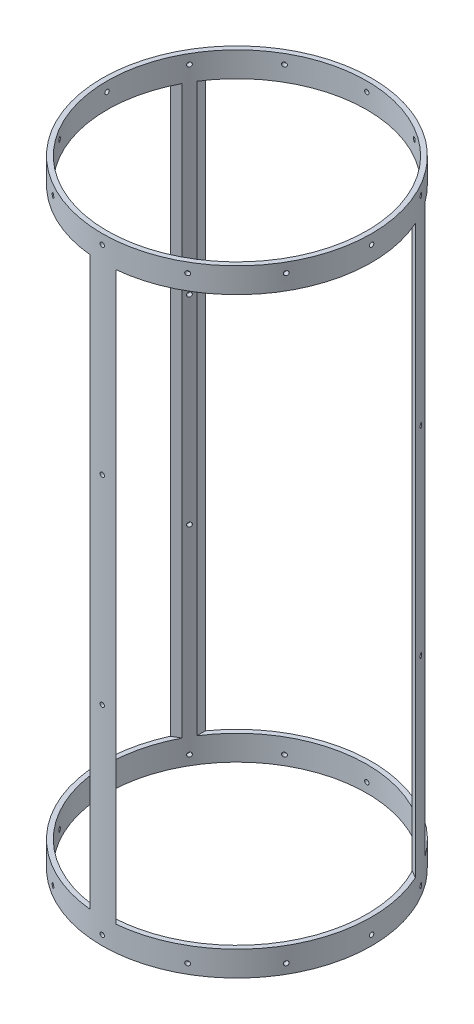
from build123d import *

# Parameters (mm, degrees)
SKETCH1_R                = 88.9
SKETCH1_R_2              = 85.725
BOSS_EXTRUDE1_DEPTH      = 203.581
CUT_EXTRUDE1_REACH       = 241.273
CUT_EXTRUDE1_END_RADIUS  = 88.9
SKETCH2_W                = 144.78
SKETCH2_H                = 374.142
CIRPATTERN1_COUNT        = 3
SKETCH4_R                = 1.4351
CUT_EXTRUDE3_DEPTH       = 15.24
CIRPATTERN3_COUNT        = 12
MIRROR1_COPY_1_SKETCH_R  = 1.4351
MIRROR1_COPY_1_DEPTH     = 15.24
MIRROR1_COPY_2_SKETCH_R  = 1.4351
MIRROR1_COPY_2_DEPTH     = 15.24
MIRROR1_COPY_3_SKETCH_R  = 1.4351
MIRROR1_COPY_3_DEPTH     = 15.24
MIRROR1_COPY_4_SKETCH_R  = 1.4351
MIRROR1_COPY_4_DEPTH     = 15.24
MIRROR1_COPY_5_SKETCH_R  = 1.4351
MIRROR1_COPY_5_DEPTH     = 15.24
MIRROR1_COPY_6_SKETCH_R  = 1.4351
MIRROR1_COPY_6_DEPTH     = 15.24
MIRROR1_COPY_7_SKETCH_R  = 1.4351
MIRROR1_COPY_7_DEPTH     = 15.24
MIRROR1_COPY_8_SKETCH_R  = 1.4351
MIRROR1_COPY_8_DEPTH     = 15.24
MIRROR1_COPY_9_SKETCH_R  = 1.4351
MIRROR1_COPY_9_DEPTH     = 15.24
MIRROR1_COPY_10_SKETCH_R = 1.4351
MIRROR1_COPY_10_DEPTH    = 15.24
MIRROR1_COPY_11_SKETCH_R = 1.4351
MIRROR1_COPY_11_DEPTH    = 15.24
SKETCH5_R                = 1.4351
CUT_EXTRUDE4_DEPTH       = 46.482
CIRPATTERN4_COUNT        = 3


with BuildPart() as part:
    # Sketch1 → Boss-Extrude1 (new, symmetric)
    with BuildSketch(Plane(origin=(0, 0, 0), x_dir=(1, 0, 0), z_dir=(0, 1, 0))):
        with Locations(Location((0, 0, 0), (0, 0, 270))):
            Circle(SKETCH1_R)
        with Locations(Location((0, 0, 0), (0, 0, 270))):
            Circle(SKETCH1_R_2, mode=Mode.SUBTRACT)
    extrude(amount=BOSS_EXTRUDE1_DEPTH, both=True)

    # Cut-Extrude1: up to this cylinder (the profile starts inside it)
    cut_extrude1_end = Plane(origin=(0, 0, 0), z_dir=(0, -1, 0)) * Cylinder(CUT_EXTRUDE1_END_RADIUS, 661.346, mode=Mode.PRIVATE)
    # Sketch2 → Cut-Extrude1 (cut, up to the surface)
    with BuildSketch(Plane.XY, mode=Mode.PRIVATE) as cut_extrude1_sk1:
        Rectangle(SKETCH2_W, SKETCH2_H)
    cut_extrude1_tool1 = extrude(cut_extrude1_sk1.sketch, amount=-CUT_EXTRUDE1_REACH, mode=Mode.PRIVATE) & cut_extrude1_end
    cut_extrude1 = cut_extrude1_tool1.solids().sort_by_distance((0, 0, 0))[0]
    add(cut_extrude1, mode=Mode.SUBTRACT)

    # CirPattern1: Cut-Extrude1 ×3 about axis
    cirpattern1_axis = Axis((0, 0, 0), (0, 1, 0))
    for i in range(1, CIRPATTERN1_COUNT):
        add(cut_extrude1.rotate(cirpattern1_axis, i * 360 / CIRPATTERN1_COUNT), mode=Mode.SUBTRACT)

    # Sketch4 → Cut-Extrude3 (cut)
    with BuildSketch(Plane(origin=(88.9, 0, 0), x_dir=(0, 0, -1), z_dir=(1, 0, 0))):
        with Locations((0, 197.231)):
            Circle(SKETCH4_R)
    cut_extrude3 = extrude(amount=-CUT_EXTRUDE3_DEPTH, mode=Mode.SUBTRACT)

    # CirPattern3: Cut-Extrude3 ×12 about axis
    cirpattern3_axis = Axis((0, 203.581, 0), (0, -1, 0))
    for i in range(1, CIRPATTERN3_COUNT):
        add(cut_extrude3.rotate(cirpattern3_axis, i * 360 / CIRPATTERN3_COUNT), mode=Mode.SUBTRACT)

    # Mirror1: Cut-Extrude3 across plane
    add(cut_extrude3.mirror(Plane.ZX), mode=Mode.SUBTRACT)

    # Mirror1 copy 1 sketch → Mirror1 copy 1 (cut)
    with BuildSketch(Plane(origin=(76.989658396, 0, 44.45), x_dir=(0.49999999999999994, 0, -0.8660254037844387), z_dir=(0.8660254037844387, 0, 0.49999999999999994))):
        with Locations((0, -197.231)):
            Circle(MIRROR1_COPY_1_SKETCH_R)
    extrude(amount=-MIRROR1_COPY_1_DEPTH, mode=Mode.SUBTRACT)

    # Mirror1 copy 2 sketch → Mirror1 copy 2 (cut)
    with BuildSketch(Plane(origin=(44.45, 0, 76.989658396), x_dir=(0.8660254037844386, 0, -0.5000000000000001), z_dir=(0.5000000000000001, 0, 0.8660254037844386))):
        with Locations((0, -197.231)):
            Circle(MIRROR1_COPY_2_SKETCH_R)
    extrude(amount=-MIRROR1_COPY_2_DEPTH, mode=Mode.SUBTRACT)

    # Mirror1 copy 3 sketch → Mirror1 copy 3 (cut)
    with BuildSketch(Plane.XY.offset(88.9)):
        with Locations((0, -197.231)):
            Circle(MIRROR1_COPY_3_SKETCH_R)
    extrude(amount=-MIRROR1_COPY_3_DEPTH, mode=Mode.SUBTRACT)

    # Mirror1 copy 4 sketch → Mirror1 copy 4 (cut)
    with BuildSketch(Plane(origin=(-44.45, 0, 76.989658396), x_dir=(0.8660254037844387, 0, 0.4999999999999998), z_dir=(-0.4999999999999998, 0, 0.8660254037844387))):
        with Locations((0, -197.231)):
            Circle(MIRROR1_COPY_4_SKETCH_R)
    extrude(amount=-MIRROR1_COPY_4_DEPTH, mode=Mode.SUBTRACT)

    # Mirror1 copy 5 sketch → Mirror1 copy 5 (cut)
    with BuildSketch(Plane(origin=(-76.989658396, 0, 44.45), x_dir=(0.49999999999999994, 0, 0.8660254037844387), z_dir=(-0.8660254037844387, 0, 0.49999999999999994))):
        with Locations((0, -197.231)):
            Circle(MIRROR1_COPY_5_SKETCH_R)
    extrude(amount=-MIRROR1_COPY_5_DEPTH, mode=Mode.SUBTRACT)

    # Mirror1 copy 6 sketch → Mirror1 copy 6 (cut)
    with BuildSketch(Plane.ZY.offset(88.9)):
        with Locations((0, -197.231)):
            Circle(MIRROR1_COPY_6_SKETCH_R)
    extrude(amount=-MIRROR1_COPY_6_DEPTH, mode=Mode.SUBTRACT)

    # Mirror1 copy 7 sketch → Mirror1 copy 7 (cut)
    with BuildSketch(Plane(origin=(-76.989658396, 0, -44.45), x_dir=(-0.5000000000000001, 0, 0.8660254037844386), z_dir=(-0.8660254037844386, 0, -0.5000000000000001))):
        with Locations((0, -197.231)):
            Circle(MIRROR1_COPY_7_SKETCH_R)
    extrude(amount=-MIRROR1_COPY_7_DEPTH, mode=Mode.SUBTRACT)

    # Mirror1 copy 8 sketch → Mirror1 copy 8 (cut)
    with BuildSketch(Plane(origin=(-44.45, 0, -76.989658396), x_dir=(-0.8660254037844384, 0, 0.5000000000000004), z_dir=(-0.5000000000000004, 0, -0.8660254037844384))):
        with Locations((0, -197.231)):
            Circle(MIRROR1_COPY_8_SKETCH_R)
    extrude(amount=-MIRROR1_COPY_8_DEPTH, mode=Mode.SUBTRACT)

    # Mirror1 copy 9 sketch → Mirror1 copy 9 (cut)
    with BuildSketch(Plane(origin=(0, 0, -88.9), x_dir=(-1, 0, 0), z_dir=(0, 0, -1))):
        with Locations((0, -197.231)):
            Circle(MIRROR1_COPY_9_SKETCH_R)
    extrude(amount=-MIRROR1_COPY_9_DEPTH, mode=Mode.SUBTRACT)

    # Mirror1 copy 10 sketch → Mirror1 copy 10 (cut)
    with BuildSketch(Plane(origin=(44.45, 0, -76.989658396), x_dir=(-0.8660254037844386, 0, -0.5000000000000001), z_dir=(0.5000000000000001, 0, -0.8660254037844386))):
        with Locations((0, -197.231)):
            Circle(MIRROR1_COPY_10_SKETCH_R)
    extrude(amount=-MIRROR1_COPY_10_DEPTH, mode=Mode.SUBTRACT)

    # Mirror1 copy 11 sketch → Mirror1 copy 11 (cut)
    with BuildSketch(Plane(origin=(76.989658396, 0, -44.45), x_dir=(-0.5000000000000004, 0, -0.8660254037844384), z_dir=(0.8660254037844384, 0, -0.5000000000000004))):
        with Locations((0, -197.231)):
            Circle(MIRROR1_COPY_11_SKETCH_R)
    extrude(amount=-MIRROR1_COPY_11_DEPTH, mode=Mode.SUBTRACT)

    # Sketch5 → Cut-Extrude4 (cut)
    with BuildSketch(Plane.XY.offset(88.9)):
        with Locations((0, -65.7606)):
            Circle(SKETCH5_R)
        with Locations((0, 65.7606)):
            Circle(SKETCH5_R)
    cut_extrude4 = extrude(amount=-CUT_EXTRUDE4_DEPTH, mode=Mode.SUBTRACT)

    # CirPattern4: Cut-Extrude4 ×3 about axis
    cirpattern4_axis = Axis((0, 203.581, 0), (0, -1, 0))
    for i in range(1, CIRPATTERN4_COUNT):
        add(cut_extrude4.rotate(cirpattern4_axis, i * 360 / CIRPATTERN4_COUNT), mode=Mode.SUBTRACT)


solid = part.part
